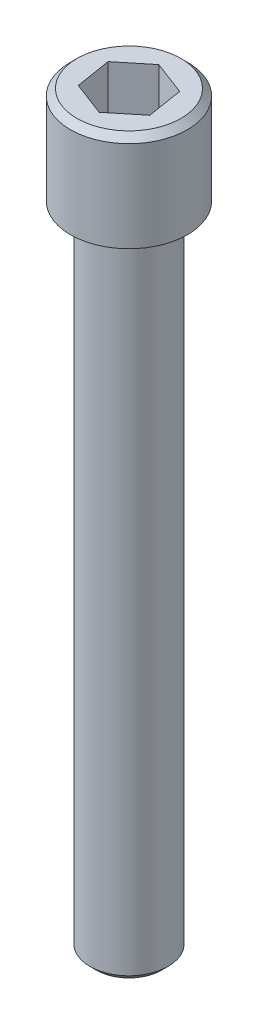
from build123d import *

# Parameters (mm, degrees)
SKICA1_R                 = 1.5
P_IDAT_VYSUNUT_M1_DEPTH  = 25
SKICA2_R                 = 2.25
P_IDAT_VYSUNUT_M2_DEPTH  = 3.75
ODEBRAT_VYSUNUT_M1_DEPTH = 2.25
ZKOSEN_1_SIZE            = 0.25
ZKOSEN_2_SIZE            = 0.25


with BuildPart() as part:
    # Skica1 → Přidat vysunutím1 (new body)
    with BuildSketch(Plane(origin=(0, 0, 0), x_dir=(1, 0, 0), z_dir=(0, 1, 0))):
        with Locations(Location((0, 0, 0), (0, 0, 270))):
            Circle(SKICA1_R)
    extrude(amount=P_IDAT_VYSUNUT_M1_DEPTH)

    # Skica2 → Přidat vysunutím2 (add)
    with BuildSketch(Plane(origin=(0, 25, 0), x_dir=(1, 0, 0), z_dir=(0, 1, 0))):
        with Locations(Location((0, 0, 0), (0, 0, 270))):
            Circle(SKICA2_R)
    extrude(amount=P_IDAT_VYSUNUT_M2_DEPTH)

    # Skica3 → Odebrat vysunutím1 (cut)
    with BuildSketch(Plane(origin=(0, 28.75, 0), x_dir=(1, 0, 0), z_dir=(0, 1, 0))):
        Polygon((-1.074402598, -0.875019461), (0.220587783, -1.367969674), (1.294990381, -0.492950213), (1.074402598, 0.875019461), (-0.220587783, 1.367969674), (-1.294990381, 0.492950213), align=None)
    extrude(amount=-ODEBRAT_VYSUNUT_M1_DEPTH, mode=Mode.SUBTRACT)

    # Zkosení1
    zkosen_1_edges = [part.edges().sort_by_distance(p)[0] for p in [
        (0, 28.75, -2.25),
    ]]
    chamfer(zkosen_1_edges, length=ZKOSEN_1_SIZE)

    # Zkosení2
    zkosen_2_edges = [part.edges().sort_by_distance(p)[0] for p in [
        (0, 0, -1.5),
    ]]
    chamfer(zkosen_2_edges, length=ZKOSEN_2_SIZE)


solid = part.part
